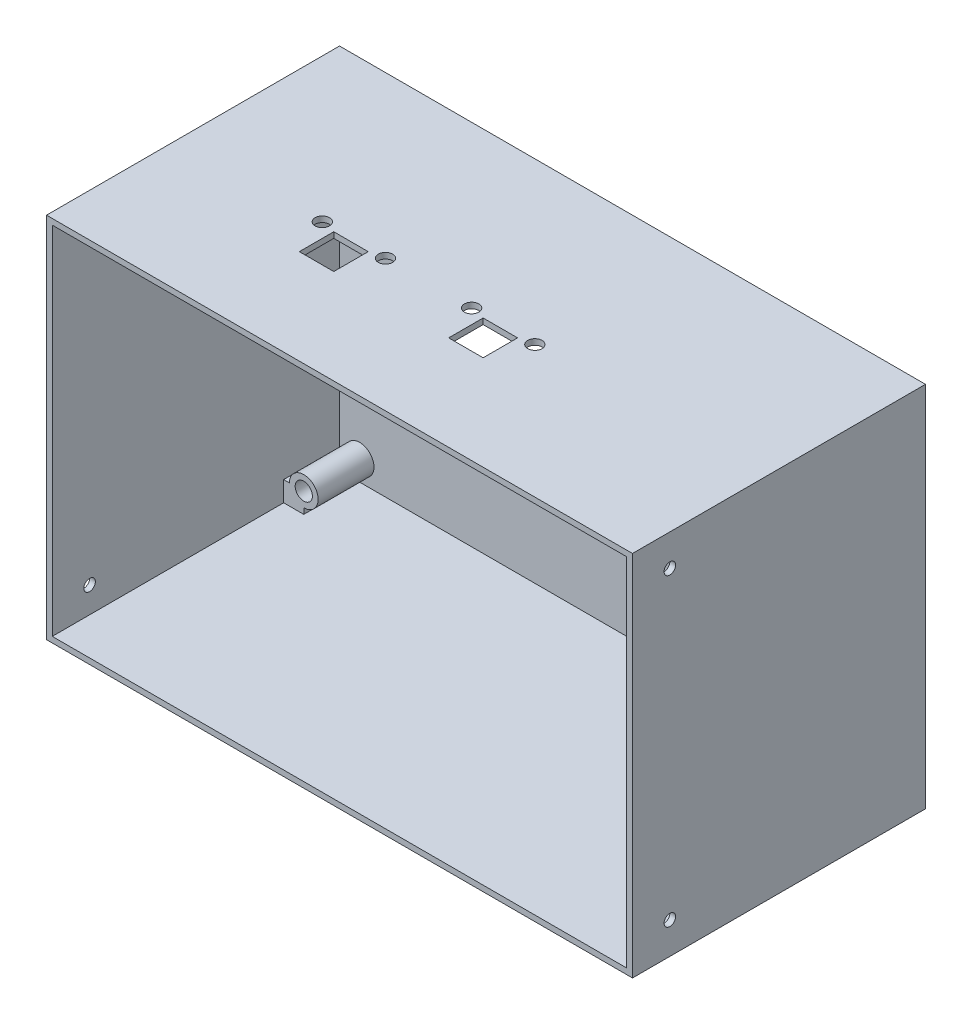
from build123d import *

# Parameters (mm, degrees)
SKETCH_1_W               = 102
SKETCH_1_H               = 64
EXTRUDE_1_DEPTH          = 50
SKETCH_1_3_R             = 1.5
EXTRUDE_2_DEPTH          = 9.72
SKETCH_4_W               = 102
SKETCH_4_H               = 1
EXTRUDE_3_DEPTH          = 64
SKETCH_1_5_W             = 76
SKETCH_1_5_H             = 25.8
CUT_EXTRUDE_1_DEPTH      = 1
CUT_EXTRUDE_2_DEPTH      = 102
CUT_EXTRUDE_2_DEPTH_BACK = 1
SKETCH_5_R               = 1
SKETCH_6_R               = 1.25
SKETCH_6_W               = 6
SKETCH_6_H               = 6
CUT_EXTRUDE_3_DEPTH      = 10


with BuildPart() as part:
    # Эскиз1 → Бобышка-Вытянуть1 (new body)
    with BuildSketch(Plane.XY):
        with Locations((53, 34)):
            Rectangle(SKETCH_1_W, SKETCH_1_H)
        Polygon((3, 61.5), (3, 65), (6.5, 65), (99.5, 65), (103, 65), (103, 61.5), (103, 6.5), (103, 3), (99.5, 3), (6.5, 3), (3, 3), (3, 6.5), align=None, mode=Mode.SUBTRACT)
    extrude(amount=EXTRUDE_1_DEPTH)

    # Эскиз1<3> → Бобышка-Вытянуть2 (add)
    # profile 1 of 4: a face of its own
    with BuildSketch(Plane.XY):
        with BuildLine():
            Line((6.5, 65), (3, 65))
            Line((3, 65), (3, 61.5))
            Line((3, 61.5), (4, 61.5))
            ThreePointArc((4, 61.5), (8.267766953, 59.732233047), (6.5, 64))
            Line((6.5, 64), (6.5, 65))
        make_face()
        with Locations((6.5, 61.5)):
            Circle(SKETCH_1_3_R, mode=Mode.SUBTRACT)
    # profile 2 of 4: a face of its own
    with BuildSketch(Plane.XY):
        with BuildLine():
            Line((103, 65), (99.5, 65))
            Line((99.5, 65), (99.5, 64))
            ThreePointArc((99.5, 64), (97.732233047, 59.732233047), (102, 61.5))
            Line((102, 61.5), (103, 61.5))
            Line((103, 61.5), (103, 65))
        make_face()
        with Locations((99.5, 61.5)):
            Circle(SKETCH_1_3_R, mode=Mode.SUBTRACT)
    # profile 3 of 4: a face of its own
    with BuildSketch(Plane.XY):
        with BuildLine():
            Line((4, 6.5), (3, 6.5))
            Line((3, 6.5), (3, 3))
            Line((3, 3), (6.5, 3))
            Line((6.5, 3), (6.5, 4))
            ThreePointArc((6.5, 4), (8.267766953, 8.267766953), (4, 6.5))
        make_face()
        with Locations((6.5, 6.5)):
            Circle(SKETCH_1_3_R, mode=Mode.SUBTRACT)
    # profile 4 of 4: a face of its own
    with BuildSketch(Plane.XY):
        with BuildLine():
            Line((103, 3), (103, 6.5))
            Line((103, 6.5), (102, 6.5))
            ThreePointArc((102, 6.5), (97.732233047, 8.267766953), (99.5, 4))
            Line((99.5, 4), (99.5, 3))
            Line((99.5, 3), (103, 3))
        make_face()
        with Locations((99.5, 6.5)):
            Circle(SKETCH_1_3_R, mode=Mode.SUBTRACT)
    extrude(amount=EXTRUDE_2_DEPTH)

    # Эскиз4 → Бобышка-Вытянуть3 (add)
    with BuildSketch(Plane(origin=(0, 66, 0), x_dir=(1, 0, 0), z_dir=(0, 1, 0))):
        with Locations((53, 0.5)):
            Rectangle(SKETCH_4_W, SKETCH_4_H)
    extrude(amount=-EXTRUDE_3_DEPTH)

    # Эскиз1<5> → Вырез-Вытянуть1 (cut)
    with BuildSketch(Plane.XY):
        with Locations((53, 34)):
            Rectangle(SKETCH_1_5_W, SKETCH_1_5_H)
    extrude(amount=-CUT_EXTRUDE_1_DEPTH, mode=Mode.SUBTRACT)

    # Эскиз5 → Вырез-Вытянуть2 (cut, two sides: drawn at the far end of the back side and taken through both)
    with BuildSketch(Plane.ZY.offset(-103).offset(-CUT_EXTRUDE_2_DEPTH_BACK)):
        with Locations((43.5, 7.5)):
            Circle(SKETCH_5_R)
        with Locations((43.5, 60.5)):
            Circle(SKETCH_5_R)
    extrude(amount=CUT_EXTRUDE_2_DEPTH + CUT_EXTRUDE_2_DEPTH_BACK, mode=Mode.SUBTRACT)

    # Эскиз6 → Вырез-Вытянуть3 (cut)
    with BuildSketch(Plane(origin=(0, 66, 0), x_dir=(1, 0, 0), z_dir=(0, 1, 0))):
        with Locations((27, -27)):
            Circle(SKETCH_6_R)
        with Locations((38, -27)):
            Circle(SKETCH_6_R)
        with Locations((53, -27)):
            Circle(SKETCH_6_R)
        with Locations((64, -27)):
            Circle(SKETCH_6_R)
        with Locations((32.5, -30.5)):
            Rectangle(SKETCH_6_W, SKETCH_6_H)
        with Locations((58.5, -30.5)):
            Rectangle(SKETCH_6_W, SKETCH_6_H)
    extrude(amount=-CUT_EXTRUDE_3_DEPTH, mode=Mode.SUBTRACT)


solid = part.part
